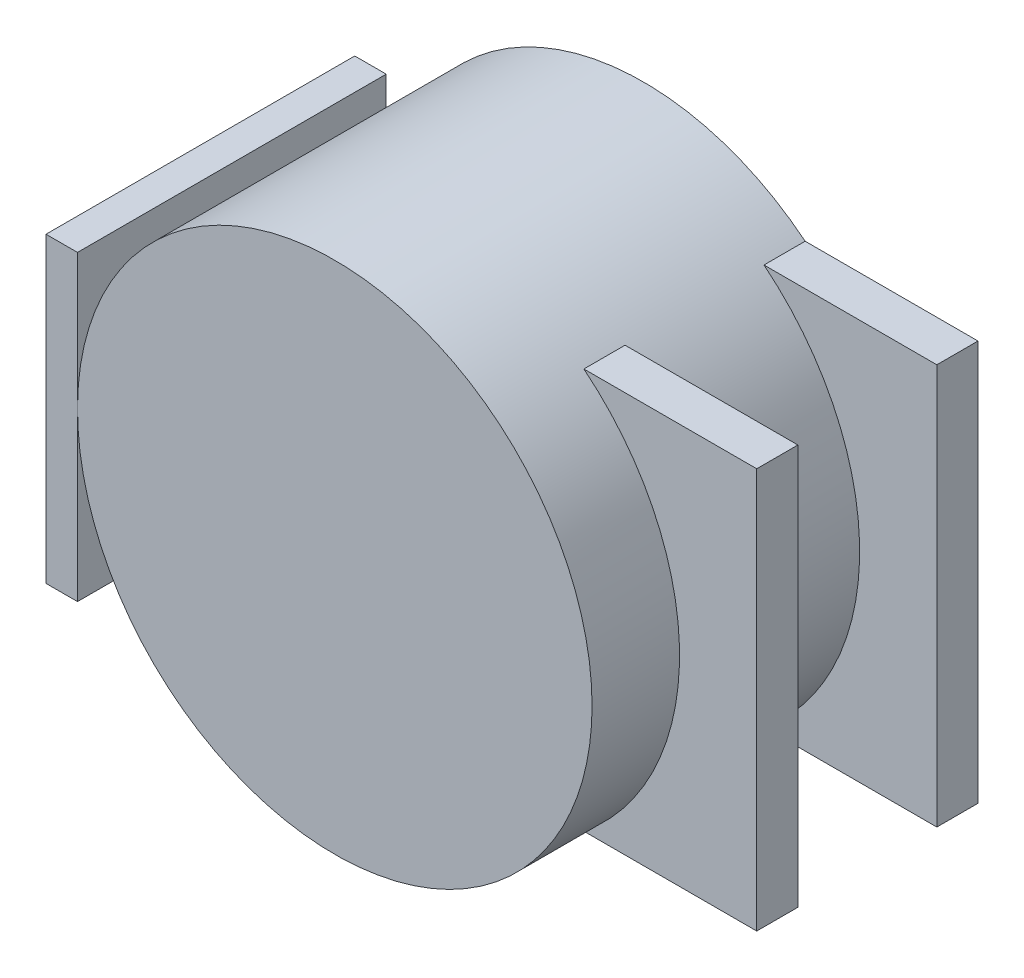
from build123d import *

# Parameters (mm, degrees)
SKETCH_1_R             = 5
EXTRUDE_1_DEPTH        = 6
SKETCH_2_W             = 0.611830912
SKETCH_2_H             = 5.877066701
EXTRUDE_2_DEPTH        = 6
SKETCH_3_W             = 0.8
SKETCH_3_H             = 7.780395236
EXTRUDE_3_DEPTH        = 6.5
PATTERN_LINEAR_1_COUNT = 2
PATTERN_LINEAR_1_PITCH = 3.5


with BuildPart() as part:
    # 草图1 → 凸台-拉伸1 (new body)
    with BuildSketch(Plane.XY):
        Circle(SKETCH_1_R)
    extrude(amount=EXTRUDE_1_DEPTH)

    # 草图3 → 凸台-拉伸3 (add)
    with BuildSketch(Plane(origin=(0, 0, 0), x_dir=(0, 0, -1), z_dir=(1, 0, 0))):
        with Locations((-0.4, 0)):
            Rectangle(SKETCH_3_W, SKETCH_3_H)
    extrude_3 = extrude(amount=EXTRUDE_3_DEPTH)

    # 阵列(线性)1: 凸台-拉伸3 ×2
    with Locations(*[(0, 0, i * PATTERN_LINEAR_1_PITCH) for i in range(1, PATTERN_LINEAR_1_COUNT)]):
        add(extrude_3)


with BuildPart() as body_2:
    # 草图2 → 凸台-拉伸2 (new body)
    with BuildSketch(Plane(origin=(0, 0, 0), x_dir=(-1, 0, 0), z_dir=(0, 0, -1))):
        with Locations((5.305915456, -0.307115125)):
            Rectangle(SKETCH_2_W, SKETCH_2_H)
    extrude(amount=-EXTRUDE_2_DEPTH)


solid = Compound([part.part, body_2.part])
